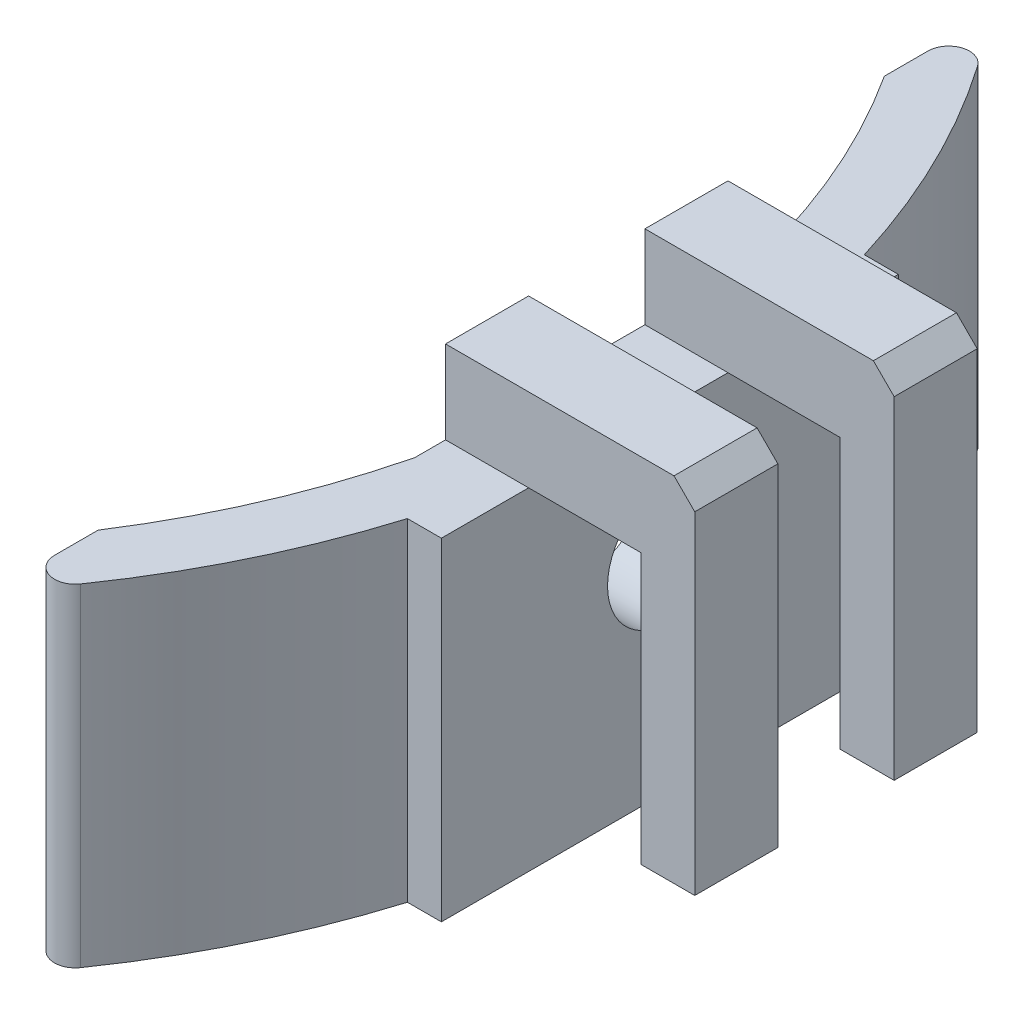
from build123d import *
from build123d.topology import SkipClean

# Parameters (mm, degrees)
EXTRUDE_1_DEPTH      = 2
SKETCH_3_W           = 2
SKETCH_3_H           = 2
EXTRUDE_3_DEPTH      = 4
SKETCH_4_W           = 1.3
SKETCH_4_H           = 2
EXTRUDE_4_DEPTH      = 6.5
SKETCH_5_W           = 2
SKETCH_5_H           = 11
EXTRUDE_5_DEPTH      = 2
CHAMFER_1_SIZE       = 0.5
SKETCH_6_R           = 1.5
CUT_EXTRUDE_1_DEPTH  = 2
EXTRUDE_6_DEPTH      = 2
EXTRUDE_6_DEPTH_BACK = 6
CUT_EXTRUDE_START    = -2
CUT_EXTRUDE_2_DEPTH  = 2


with BuildPart() as part:
    # 草图1 → 凸台-拉伸1 (new body)
    with BuildSketch(Plane(origin=(0, 0, 0), x_dir=(0, 0, -1), z_dir=(1, 0, 0))):
        Polygon((-5.5, -3), (5.5, -3), (5.5, 3), (3.4, 3), (3.4, 5), (1.4, 5), (1.4, 3), (-1.4, 3), (-1.4, 5), (-3.4, 5), (-3.4, 3), (-5.5, 3), align=None)
    extrude(amount=EXTRUDE_1_DEPTH)

    # 草图3 → 凸台-拉伸3 (add)
    with BuildSketch(Plane(origin=(2, 0, 0), x_dir=(0, 0, -1), z_dir=(1, 0, 0))):
        with Locations((-2.4, 4)):
            Rectangle(SKETCH_3_W, SKETCH_3_H)
        with Locations((2.4, 4)):
            Rectangle(SKETCH_3_W, SKETCH_3_H)
    extrude(amount=EXTRUDE_3_DEPTH)

    # 草图4 → 凸台-拉伸4 (add)
    with BuildSketch(Plane.XZ.offset(-3)):
        with Locations((5.35, 2.4)):
            Rectangle(SKETCH_4_W, SKETCH_4_H)
        with Locations((5.35, -2.4)):
            Rectangle(SKETCH_4_W, SKETCH_4_H)
    extrude(amount=EXTRUDE_4_DEPTH)

    # 草图5 → 凸台-拉伸5 (add)
    with BuildSketch(Plane.XZ.offset(3)):
        with Locations((1, 0)):
            Rectangle(SKETCH_5_W, SKETCH_5_H)
    extrude(amount=EXTRUDE_5_DEPTH)

    # 倒角1
    chamfer_1_edges = [part.edges().sort_by_distance(p)[0] for p in [
        (6, 5, 2.4),
        (6, 5, -2.4),
    ]]
    chamfer(chamfer_1_edges, length=CHAMFER_1_SIZE)

    # 草图6 → 切除-拉伸1 (cut)
    with BuildSketch(Plane.ZY):
        Circle(SKETCH_6_R)
    extrude(amount=-CUT_EXTRUDE_1_DEPTH, mode=Mode.SUBTRACT)

    # 草图2 → 凸台-拉伸6 (add, two sides: drawn at the far end of the back side and taken through both)
    with SkipClean():  # the faces are left unmerged after this step: merging them gives an invalid solid
        with BuildSketch(Plane.XZ.offset(3).offset(-EXTRUDE_6_DEPTH_BACK)):
            with BuildLine():
                Line((-2.3, 10.512451089), (-2.3, 9.464007706))
                ThreePointArc((-2.3, 9.464007706), (0.5, 0), (-2.3, -9.464007706))
                Line((-2.3, -9.464007706), (-2.3, -10.512451089))
                ThreePointArc((-2.3, -10.512451089), (-1.949751675, -10.989498714), (-1.389702257, -10.798205813))
                ThreePointArc((-1.389702257, -10.798205813), (2, 0), (-1.389702257, 10.798205813))
                ThreePointArc((-1.389702257, 10.798205813), (-1.949751675, 10.989498714), (-2.3, 10.512451089))
            make_face()
        extrude(amount=EXTRUDE_6_DEPTH + EXTRUDE_6_DEPTH_BACK)

    # 草图7 → 切除-拉伸2 (cut)
    with SkipClean():  # the faces are left unmerged after this step: merging them gives an invalid solid
        with BuildSketch(Plane(origin=(2, 0, 0), x_dir=(0, 0, -1), z_dir=(1, 0, 0)).offset(CUT_EXTRUDE_START)):
            with BuildLine():
                ThreePointArc((0, -1.5), (1.5, 0), (0, 1.5))
                ThreePointArc((0, 1.5), (-1.5, 0), (0, -1.5))
            make_face()
        extrude(amount=CUT_EXTRUDE_2_DEPTH, mode=Mode.SUBTRACT)


solid = part.part
